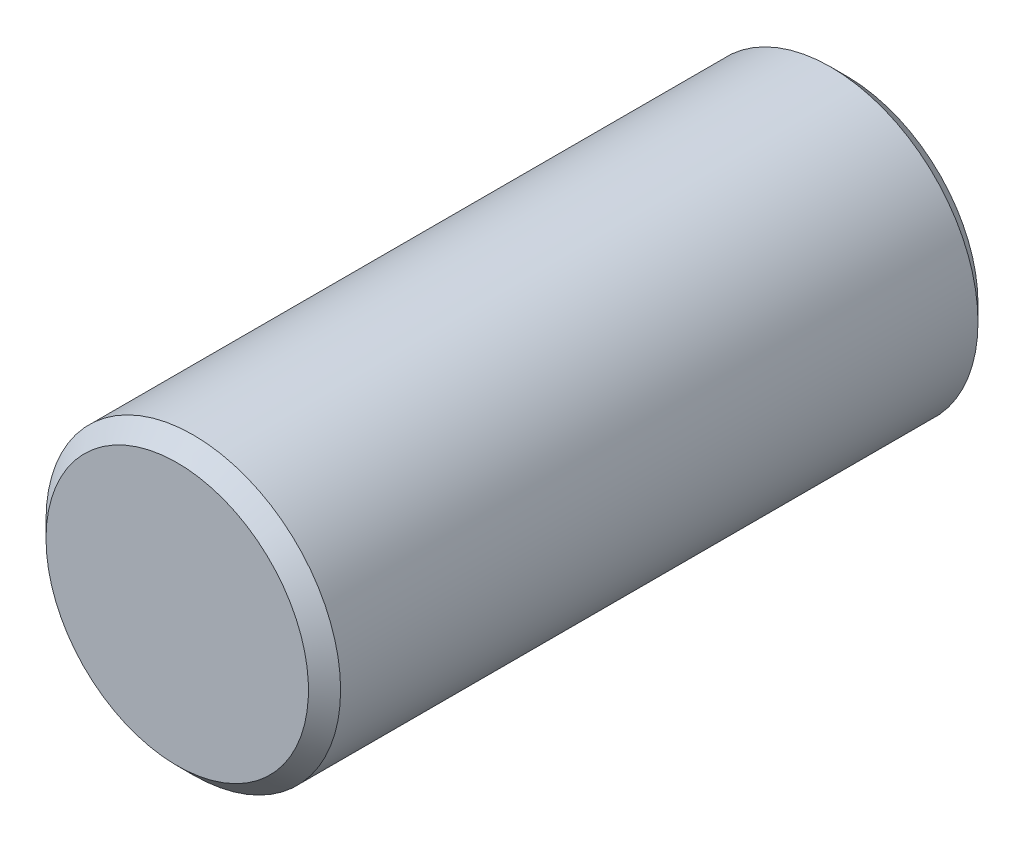
from build123d import *

# Parameters (mm, degrees)
SKETCH_1_R      = 27.5
EXTRUDE_1_DEPTH = 62.5
CHAMFER_1_SIZE  = 3


with BuildPart() as part:
    # 草图1 → 凸台-拉伸1 (new, symmetric)
    with BuildSketch(Plane.XY):
        Circle(SKETCH_1_R)
    extrude(amount=EXTRUDE_1_DEPTH, both=True)

    # 倒角1
    chamfer_1_edges = [part.edges().sort_by_distance(p)[0] for p in [
        (-27.5, 0, -62.5),
        (-27.5, 0, 62.5),
    ]]
    chamfer(chamfer_1_edges, length=CHAMFER_1_SIZE)


solid = part.part
